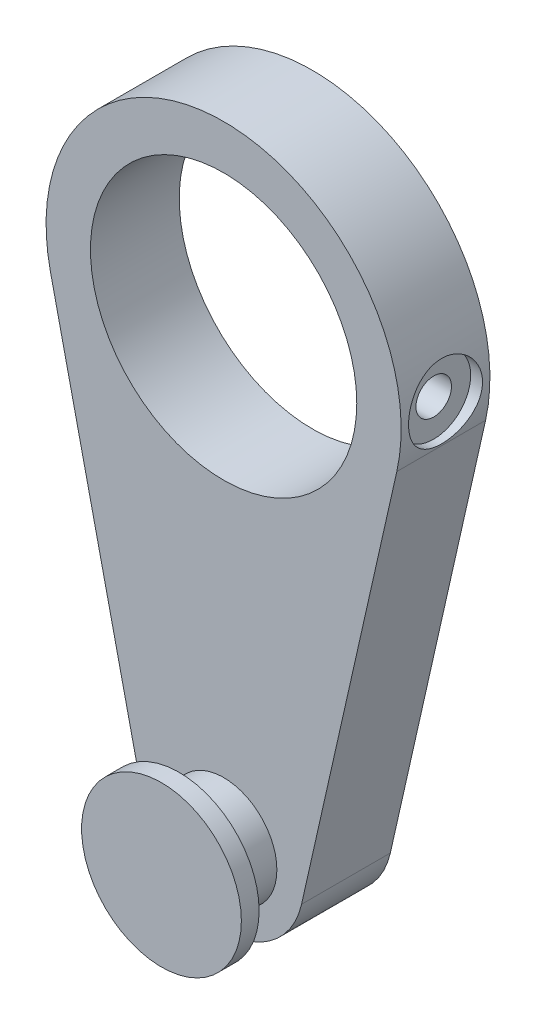
from build123d import *

# Parameters (mm, degrees)
SKETCH1_R           = 5.08
SKETCH1_R_2         = 3.81
SKETCH1_R_3         = 2.286
BOSS_EXTRUDE1_DEPTH = 2.54
SKETCH2_R           = 1.524
BOSS_EXTRUDE2_DEPTH = 1.27
SKETCH3_R           = 2.286
BOSS_EXTRUDE3_DEPTH = 0.508
SCALE1_SCALE        = 1.5
CUT_EXTRUDE1_START  = 7.112
SKETCH4_R           = 1.5875
CUT_EXTRUDE1_DEPTH  = 10
SKETCH5_R           = 0.762
CUT_EXTRUDE2_DEPTH  = 22.655627009


with BuildPart() as part:
    # Sketch1 → Boss-Extrude1 (new body)
    # profile 1 of 3: a face of its own
    with BuildSketch(Plane.XY):
        Circle(SKETCH1_R)
        Circle(SKETCH1_R_2, mode=Mode.SUBTRACT)
    # profile 2 of 3: a face of its own
    with BuildSketch(Plane.XY):
        with BuildLine():
            ThreePointArc((4.955539349, -1.1176), (0, -5.08), (-4.955539349, -1.1176))
            Line((-4.955539349, -1.1176), (-2.229992707, -13.20292))
            ThreePointArc((-2.229992707, -13.20292), (-0.253014497, -10.428044969), (2.286, -12.7))
            ThreePointArc((2.286, -12.7), (2.271955031, -12.953014497), (2.229992707, -13.20292))
            Line((2.229992707, -13.20292), (4.955539349, -1.1176))
        make_face()
    # profile 3 of 3: a face of its own
    with BuildSketch(Plane.XY):
        with Locations((0, -12.7)):
            Circle(SKETCH1_R_3)
    extrude(amount=BOSS_EXTRUDE1_DEPTH)

    # Sketch2 → Boss-Extrude2 (add)
    with BuildSketch(Plane.XY.offset(2.54)):
        with Locations((0, -12.7)):
            Circle(SKETCH2_R)
    extrude(amount=BOSS_EXTRUDE2_DEPTH)

    # Sketch3 → Boss-Extrude3 (add)
    with BuildSketch(Plane.XY.offset(3.81)):
        with Locations((0, -12.7)):
            Circle(SKETCH3_R)
    extrude(amount=BOSS_EXTRUDE3_DEPTH)


with BuildPart() as part_1:
    # Scale1: scaled about (0, -6.091225053, 1.422264494)
    add(part.part.scale(SCALE1_SCALE).moved(Location((0, 3.045612526, -0.711132247))))

    # Sketch4 → Cut-Extrude1 (cut)
    with BuildSketch(Plane(origin=(0, 0, 0), x_dir=(0, 0, -1), z_dir=(1, 0, 0)).offset(CUT_EXTRUDE1_START)):
        with Locations(Location((-1.193867753, 3.045612527, 0), (0, 0, 180))):
            Circle(SKETCH4_R)
    extrude(amount=CUT_EXTRUDE1_DEPTH, mode=Mode.SUBTRACT)

    # Sketch5 → Cut-Extrude2 (cut, through all)
    with BuildSketch(Plane(origin=(0, 0, 0), x_dir=(0, 0, -1), z_dir=(1, 0, 0))):
        with Locations((-1.193867753, 3.045612527)):
            Circle(SKETCH5_R)
    extrude(amount=CUT_EXTRUDE2_DEPTH, mode=Mode.SUBTRACT)


solid = part_1.part
